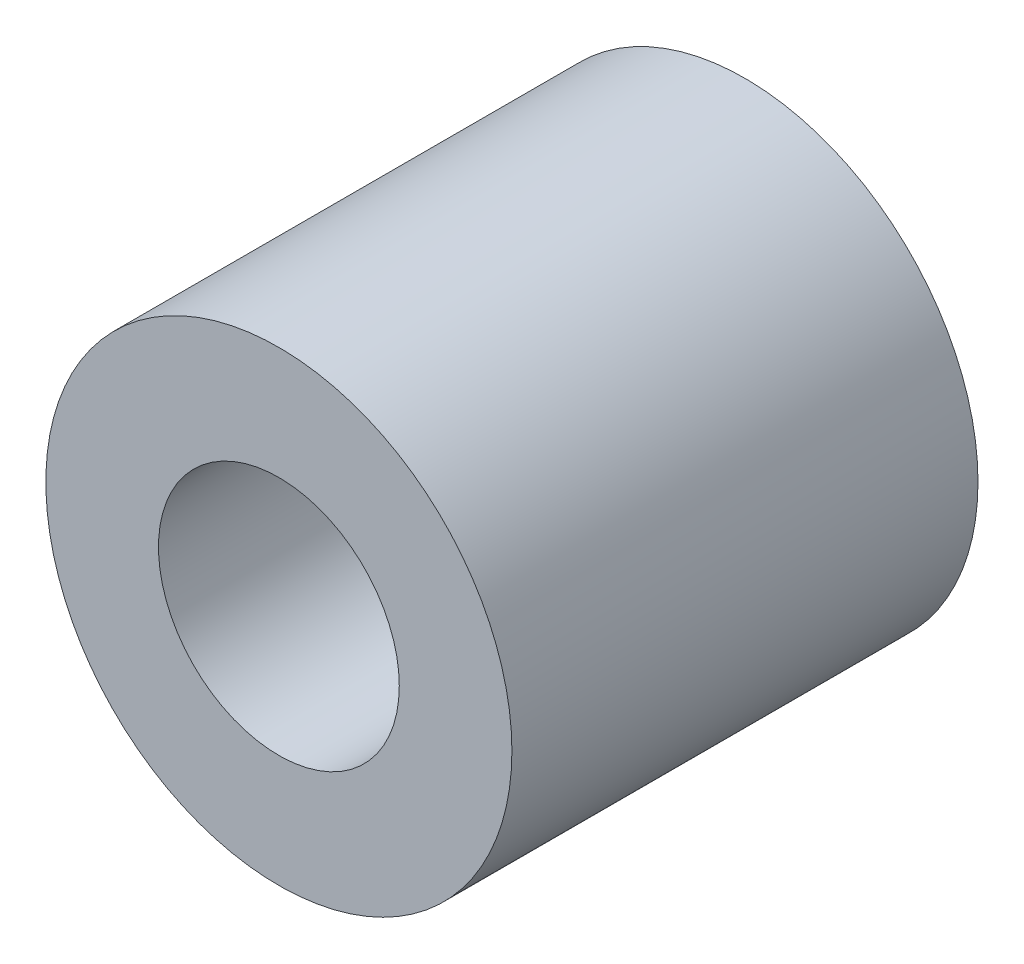
from build123d import *

# Parameters (mm, degrees)
ESQUISSE1_R             = 3
BOSS_EXTRU_1_DEPTH      = 6
ESQUISSE2_R             = 1.55
ENL_V_MAT_EXTRU_1_DEPTH = 8.348469228


with BuildPart() as part:
    # Esquisse1 → Boss.-Extru.1 (new body)
    with BuildSketch(Plane.XY):
        Circle(ESQUISSE1_R)
    extrude(amount=BOSS_EXTRU_1_DEPTH)

    # Esquisse2 → Enlèv. mat.-Extru.1 (cut, through all)
    with BuildSketch(Plane.XY.offset(6)):
        Circle(ESQUISSE2_R)
    extrude(amount=-ENL_V_MAT_EXTRU_1_DEPTH, mode=Mode.SUBTRACT)


solid = part.part
